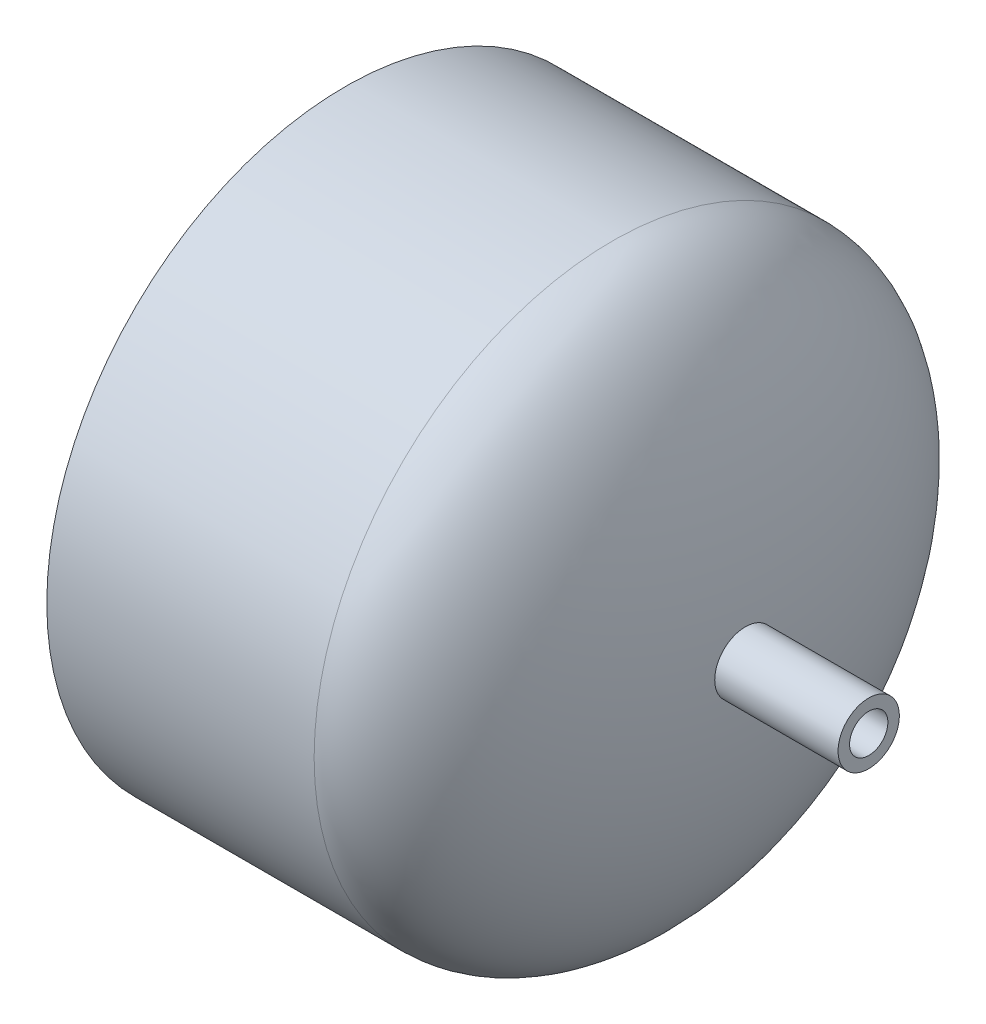
from build123d import *

# Parameters (mm, degrees)
BOSS_EXTRUDE1_DEPTH      = 50.8
BOSS_EXTRUDE1_DEPTH_BACK = 3.556
SKETCH2_R                = 12.7
SKETCH2_R_2              = 7.9375


with BuildPart() as part:
    # Sketch1 → Revolve1 (revolve)
    with BuildSketch(Plane.XY, mode=Mode.PRIVATE) as revolve1_sk:
        with BuildLine():
            Line((-166.116, -123.571), (-55.372, -123.571))
            add(Edge.make_bspline(
                [(-55.372, -123.571), (0, -123.571), (0, 0)],
                knots=[3.141592654, 3.141592654, 3.141592654, 4.71238898, 4.71238898, 4.71238898], degree=2, weights=[1, 0.707106781, 1]))
            Line((0, 0), (-14.224, 0))
            add(Edge.make_bspline(
                [(-55.372, -109.347), (-14.224, -109.347), (-14.224, 0)],
                knots=[0, 0, 0, 1.570796327, 1.570796327, 1.570796327], degree=2, weights=[1, 0.707106781, 1]))
            Line((-55.372, -109.347), (-166.116, -109.9185))
            Line((-166.116, -109.9185), (-166.116, -123.571))
        make_face()
    revolve(revolve1_sk.sketch.rotate(Axis((-166.116, 0, 0), (1, 0, 0)), 270), axis=Axis((-166.116, 0, 0), (1, 0, 0)))

    # Sketch2 → Boss-Extrude1 (add, two sides: drawn at the far end of the back side and taken through both)
    with BuildSketch(Plane(origin=(0, 0, 0), x_dir=(0, 0, -1), z_dir=(1, 0, 0)).offset(-BOSS_EXTRUDE1_DEPTH_BACK)):
        Circle(SKETCH2_R)
        Circle(SKETCH2_R_2, mode=Mode.SUBTRACT)
    extrude(amount=BOSS_EXTRUDE1_DEPTH + BOSS_EXTRUDE1_DEPTH_BACK)


solid = part.part
